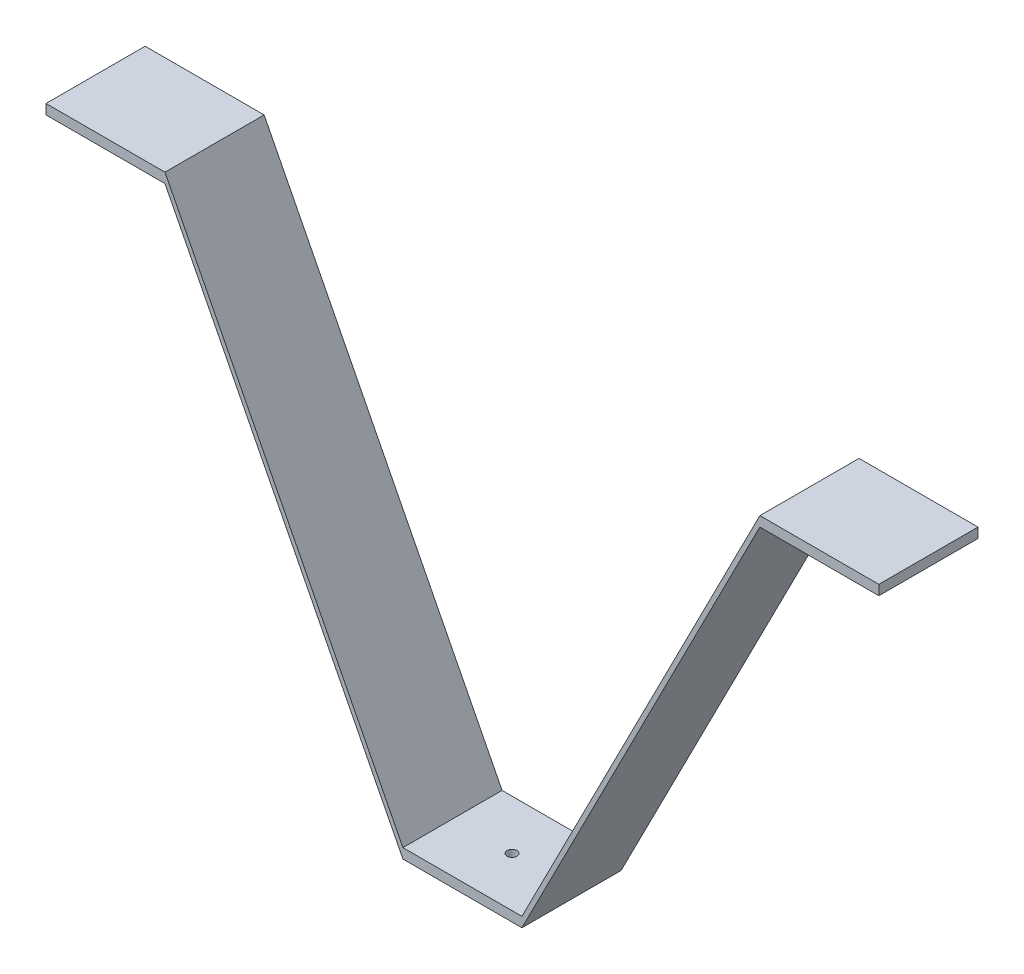
from build123d import *

# Parameters (mm, degrees)
SKETCH1_W           = 76.2
SKETCH1_H           = 63.5
BOSS_EXTRUDE1_DEPTH = 6.35
SKETCH2_R           = 3.175
CUT_EXTRUDE1_DEPTH  = 50.99995
BOSS_EXTRUDE2_DEPTH = 63.5
SKETCH4_W           = 63.5
SKETCH4_H           = 6.35
BOSS_EXTRUDE3_DEPTH = 76.2


with BuildPart() as part:
    # Sketch1 → Boss-Extrude1 (new body)
    with BuildSketch(Plane(origin=(0, 0, 0), x_dir=(1, 0, 0), z_dir=(0, 1, 0))):
        Rectangle(SKETCH1_W, SKETCH1_H)
    extrude(amount=BOSS_EXTRUDE1_DEPTH)

    # Sketch2 → Cut-Extrude1 (cut, through all)
    with BuildSketch(Plane(origin=(0, 6.35, 0), x_dir=(1, 0, 0), z_dir=(0, 1, 0))):
        with Locations(Location((0, 0, 0), (0, 0, 270))):
            Circle(SKETCH2_R)
    extrude(amount=-CUT_EXTRUDE1_DEPTH, mode=Mode.SUBTRACT)

    # Sketch3 → Boss-Extrude2 (add)
    with BuildSketch(Plane.XY.offset(31.75)):
        Polygon((38.1, 6.35), (190.5, 304.8), (190.5, 298.45), (38.1, 0), align=None)
    boss_extrude2 = extrude(amount=-BOSS_EXTRUDE2_DEPTH)

    # Sketch4 → Boss-Extrude3 (add)
    with BuildSketch(Plane(origin=(190.5, 0, 0), x_dir=(0, 0, -1), z_dir=(1, 0, 0))):
        with Locations((0, 301.625)):
            Rectangle(SKETCH4_W, SKETCH4_H)
    boss_extrude3 = extrude(amount=BOSS_EXTRUDE3_DEPTH)

    # Mirror1: Boss-Extrude2, Boss-Extrude3 across plane
    add(boss_extrude2.mirror(Plane(origin=(0, 0, 0), x_dir=(0, 0, 1), z_dir=(1, 0, 0))))
    add(boss_extrude3.mirror(Plane(origin=(0, 0, 0), x_dir=(0, 0, 1), z_dir=(1, 0, 0))))


solid = part.part
